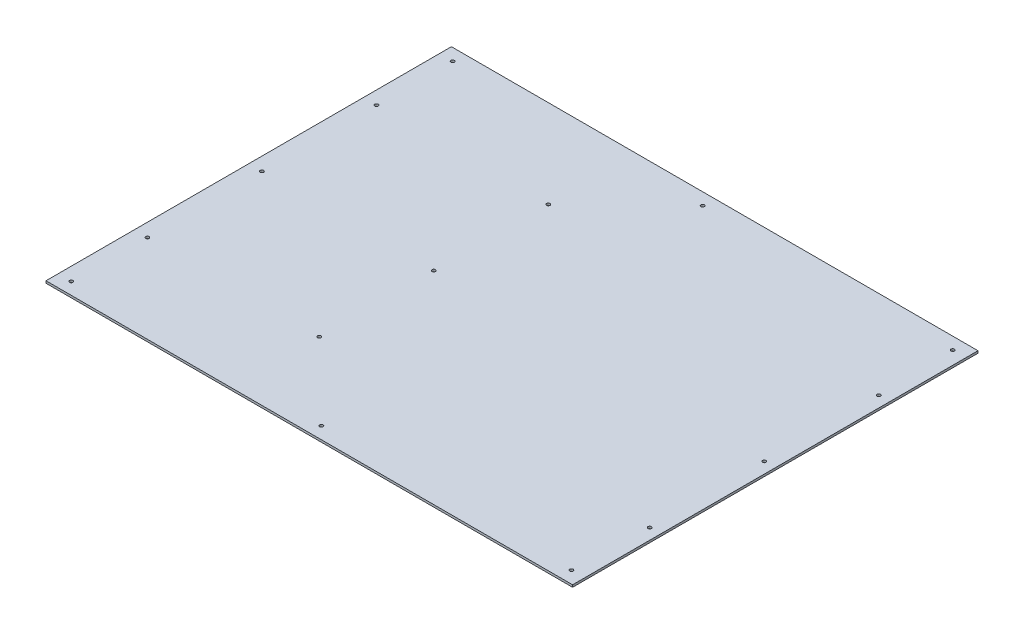
from build123d import *

# Parameters (mm, degrees)
SKETCH1_W                    = 758.825
SKETCH1_H                    = 584.2
BOSS_EXTRUDE1_DEPTH          = 3.175
F_10_0_1935_DIAMETER_HOLE2_D = 4.9149
F_10_0_1935_DIAMETER_HOLE3_D = 4.9149


with BuildPart() as part:
    # Sketch1 → Boss-Extrude1 (new body)
    with BuildSketch(Plane(origin=(0, 0, 0), x_dir=(1, 0, 0), z_dir=(0, 1, 0))):
        with Locations((379.4125, 292.1)):
            Rectangle(SKETCH1_W, SKETCH1_H)
    extrude(amount=BOSS_EXTRUDE1_DEPTH)

    # #10 (0.1935) Diameter Hole2 (through all)
    with Locations(Plane(origin=(0, 3.175, 0), x_dir=(1, 0, 0), z_dir=(0, 1, 0))):
        with Locations((19.05, 566.801), (739.775, 566.801), (19.05, 17.399), (739.775, 17.399), (379.4125, 566.801), (19.05, 292.1), (379.4125, 17.399), (742.95, 292.1), (19.05, 457.2), (19.05, 127), (742.95, 127), (742.95, 457.2)):
            Hole(F_10_0_1935_DIAMETER_HOLE2_D / 2)

    # #10 (0.1935) Diameter Hole3 (through all)
    with Locations(Plane(origin=(0, 3.175, 0), x_dir=(1, 0, 0), z_dir=(0, 1, 0))):
        with Locations((266.7, 292.1), (266.7, 127), (266.7, 457.2)):
            Hole(F_10_0_1935_DIAMETER_HOLE3_D / 2)


solid = part.part
